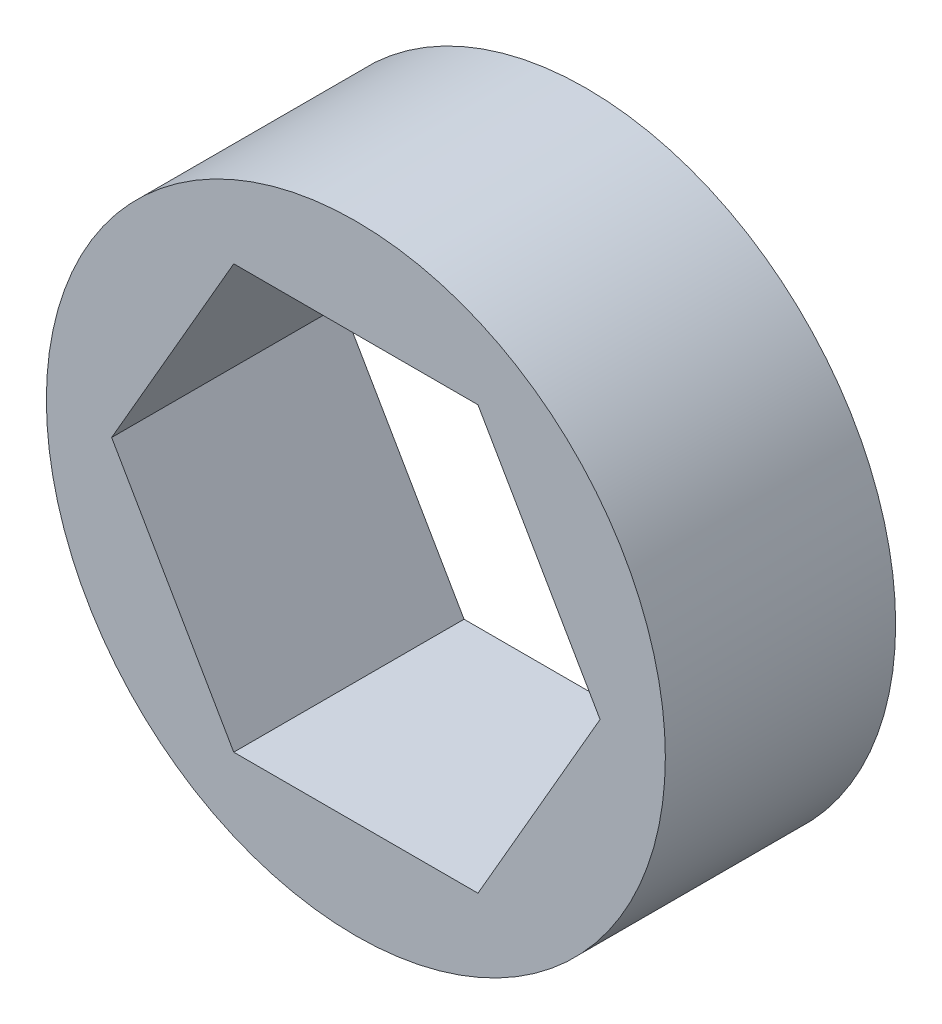
from build123d import *

# Parameters (mm, degrees)
SKETCH1_R           = 9.525
BOSS_EXTRUDE1_DEPTH = 7.08753086


with BuildPart() as part:
    # Sketch1 → Boss-Extrude1 (new body)
    with BuildSketch(Plane.XY):
        with Locations(Location((0, 0, 0), (0, 0, 180))):
            Circle(SKETCH1_R)
        Polygon((7.515657129, 0), (3.757828565, 6.50875), (-3.757828565, 6.50875), (-7.515657129, 0), (-3.757828565, -6.50875), (3.757828565, -6.50875), align=None, mode=Mode.SUBTRACT)
    extrude(amount=BOSS_EXTRUDE1_DEPTH)


solid = part.part
